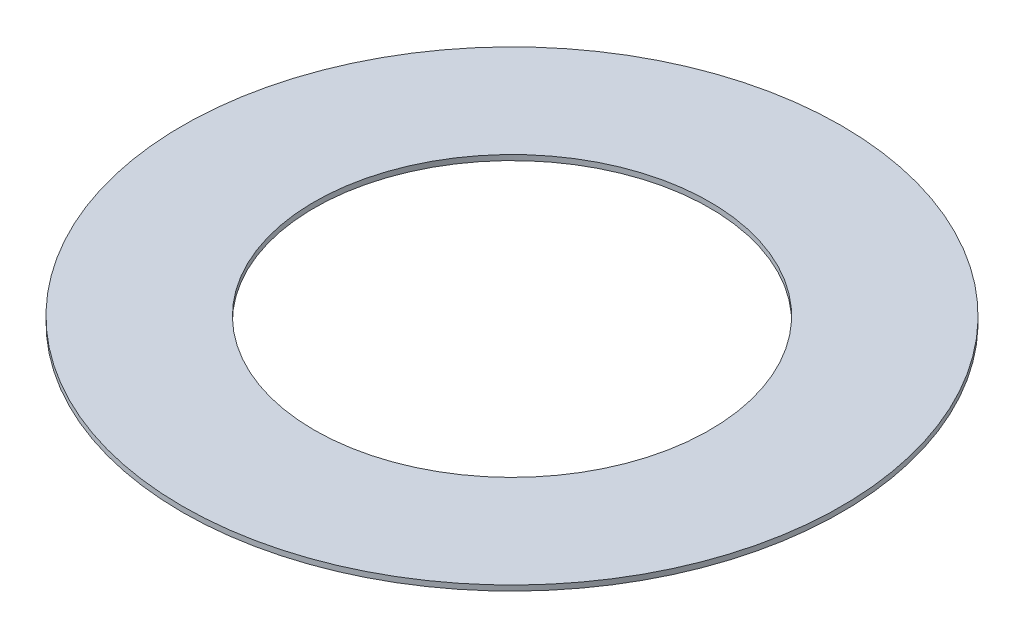
from build123d import *

# Parameters (mm, degrees)
SKETCH1_R           = 7.9375
BOSS_EXTRUDE1_DEPTH = 0.127
SKETCH5_R           = 4.7625
CUT_EXTRUDE1_DEPTH  = 12.226038549


with BuildPart() as part:
    # Sketch1 → Boss-Extrude1 (new body)
    with BuildSketch(Plane(origin=(0, 0, 0), x_dir=(1, 0, 0), z_dir=(0, 1, 0))):
        with Locations(Location((0, 0, 0), (0, 0, 270))):
            Circle(SKETCH1_R)
    extrude(amount=BOSS_EXTRUDE1_DEPTH)

    # Sketch5 → Cut-Extrude1 (cut, through all)
    with BuildSketch(Plane(origin=(0, 0.127, 0), x_dir=(-1, 0, 0), z_dir=(0, 1, 0))):
        with Locations(Location((0, 0, 0), (0, 0, 90))):
            Circle(SKETCH5_R)
    extrude(amount=-CUT_EXTRUDE1_DEPTH, mode=Mode.SUBTRACT)


solid = part.part
